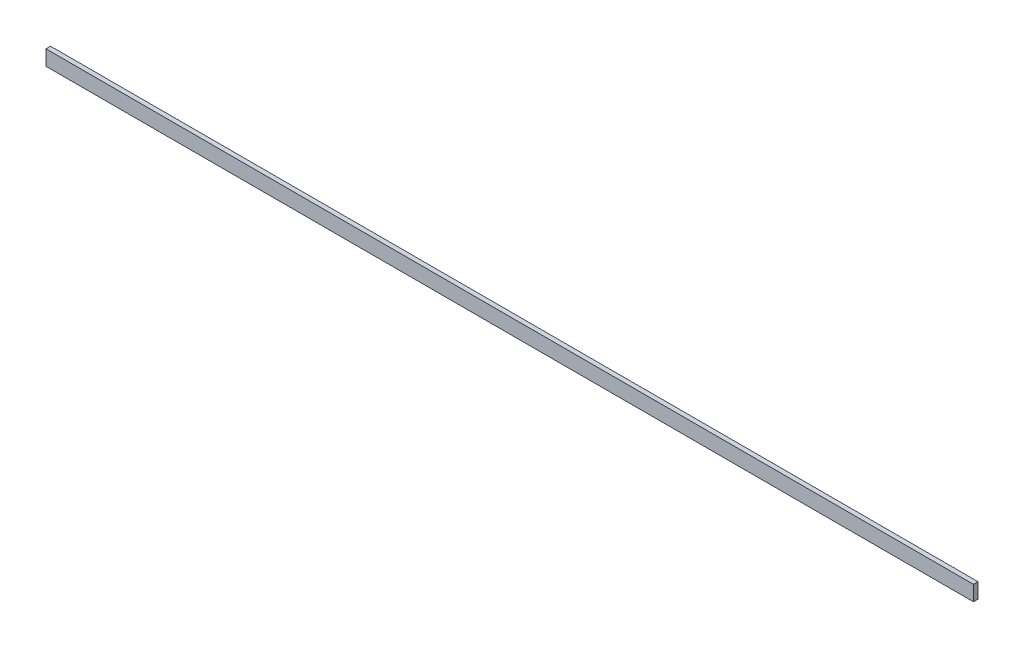
from build123d import *

# Parameters (mm, degrees)
SKETCH1_W           = 612
SKETCH1_H           = 10
BOSS_EXTRUDE1_DEPTH = 3


with BuildPart() as part:
    # Sketch1 → Boss-Extrude1 (new body)
    with BuildSketch(Plane.XY):
        with Locations((306, 5)):
            Rectangle(SKETCH1_W, SKETCH1_H)
    extrude(amount=BOSS_EXTRUDE1_DEPTH)


solid = part.part
